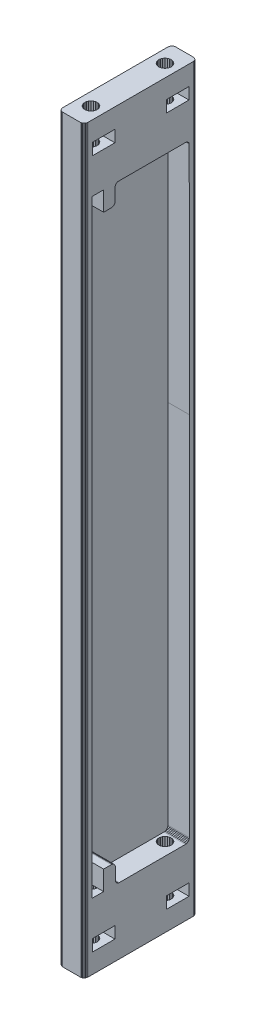
from build123d import *

# Parameters (mm, degrees)
BOSS_EXTRUDE1_DEPTH = 189.99999523
SKETCH2_W           = 5.800001324
SKETCH2_H           = 3.000000491
CUT_EXTRUDE1_DEPTH  = 146.045679533
CUT_EXTRUDE2_REACH  = 202.516
SKETCH4_W           = 5.800001324
SKETCH4_H           = 2.999998629
CUT_EXTRUDE3_DEPTH  = 146.045679533
SKETCH5_W           = 5.800001323
SKETCH5_H           = 2.999998629
CUT_EXTRUDE4_DEPTH  = 146.045679533
CUT_EXTRUDE5_REACH  = 202.516
CUT_EXTRUDE6_REACH  = 202.516
SKETCH8_W           = 5.800001323
SKETCH8_H           = 3.000000491
CUT_EXTRUDE7_DEPTH  = 146.045679533
CUT_EXTRUDE8_REACH  = 202.516
CUT_EXTRUDE9_DEPTH  = 5.49999997
CUT_EXTRUDE10_DEPTH = 9.000003338
CUT_EXTRUDE11_DEPTH = 9.000003338
CUT_EXTRUDE12_DEPTH = 8.99999754
CUT_EXTRUDE13_DEPTH = 8.99999754


with BuildPart() as part:
    # Sketch1 → Boss-Extrude1 (new body)
    with BuildSketch(Plane(origin=(0, 129.999995232, 0), x_dir=(1, 0, 0), z_dir=(0, 1, 0))):
        Polygon((-2.749999985, 35.133976489), (-2.508819103, 35.034071654), (-2.249999903, 35.000000149), (2.249999903, 35.000000149), (2.508819103, 35.034071654), (2.749999985, 35.133976489), (2.957106801, 35.292893648), (3.116025357, 35.500001162), (3.215926001, 35.741180182), (3.250000067, 35.99999845), (3.250000067, 63.000001013), (3.215926001, 63.258819282), (3.116025357, 63.500002027), (2.957106801, 63.707105815), (2.749999985, 63.8660267), (2.508819103, 63.965924084), (2.249999903, 64.00000304), (-2.249999903, 64.00000304), (-2.508819103, 63.965924084), (-2.749999985, 63.8660267), (-2.957106801, 63.707105815), (-3.116025357, 63.500002027), (-3.215926001, 63.258819282), (-3.250000067, 63.000001013), (-3.250000067, 35.99999845), (-3.215926001, 35.741180182), (-3.116025357, 35.500001162), (-2.957106801, 35.292893648), align=None)
    extrude(amount=-BOSS_EXTRUDE1_DEPTH)

    # Sketch2 → Cut-Extrude1 (cut, through all)
    with BuildSketch(Plane(origin=(3.250000067, 0, 0), x_dir=(0, 0, -1), z_dir=(1, 0, 0))):
        with Locations((39.999999106, -53.499999753)):
            Rectangle(SKETCH2_W, SKETCH2_H)
    extrude(amount=-CUT_EXTRUDE1_DEPTH, mode=Mode.SUBTRACT)

    # Sketch3 → Cut-Extrude2 (cut, up to next)
    with BuildSketch(Plane.XZ.offset(59.999999998), mode=Mode.PRIVATE) as cut_extrude2_sk1:
        Polygon((-1.545481267, -40.414113551), (-1.385640586, -40.799997747), (-1.131370896, -41.13136977), (-0.800000038, -41.385639459), (-0.414110487, -41.545484215), (0, -41.600000113), (0.414110487, -41.545484215), (0.800000038, -41.385639459), (1.131370896, -41.13136977), (1.385640586, -40.799997747), (1.545481267, -40.414113551), (1.600000076, -39.999999106), (1.545481267, -39.585888386), (1.385640586, -39.200000465), (1.131370896, -38.868628442), (0.800000038, -38.614362478), (0.414110487, -38.454517722), (0, -38.400001824), (-0.414110487, -38.454517722), (-0.800000038, -38.614362478), (-1.131370896, -38.868628442), (-1.385640586, -39.200000465), (-1.545481267, -39.585888386), (-1.600000076, -39.999999106), align=None)
    cut_extrude2_tool1 = extrude(cut_extrude2_sk1.sketch, amount=-CUT_EXTRUDE2_REACH, mode=Mode.PRIVATE) & part.part
    add(cut_extrude2_tool1.solids().sort_by_distance((0, -60, -40))[0], mode=Mode.SUBTRACT)

    # Sketch4 → Cut-Extrude3 (cut, through all)
    with BuildSketch(Plane(origin=(3.250000067, 0, 0), x_dir=(0, 0, -1), z_dir=(1, 0, 0))):
        with Locations((39.999999106, 123.500000686)):
            Rectangle(SKETCH4_W, SKETCH4_H)
    extrude(amount=-CUT_EXTRUDE3_DEPTH, mode=Mode.SUBTRACT)

    # Sketch5 → Cut-Extrude4 (cut, through all)
    with BuildSketch(Plane(origin=(3.250000067, 0, 0), x_dir=(0, 0, -1), z_dir=(1, 0, 0))):
        with Locations((59.000000357, 123.500000686)):
            Rectangle(SKETCH5_W, SKETCH5_H)
    extrude(amount=-CUT_EXTRUDE4_DEPTH, mode=Mode.SUBTRACT)

    # Sketch6 → Cut-Extrude5 (cut, up to next)
    with BuildSketch(Plane(origin=(0, 129.999995232, 0), x_dir=(-1, 0, 0), z_dir=(0, 1, 0)), mode=Mode.PRIVATE) as cut_extrude5_sk1:
        Polygon((1.545481267, -39.585888386), (1.385640586, -39.200000465), (1.131370896, -38.868628442), (0.800000038, -38.614362478), (0.414110487, -38.454517722), (0, -38.400001824), (-0.414110487, -38.454517722), (-0.800000038, -38.614362478), (-1.131370896, -38.868628442), (-1.385640586, -39.200000465), (-1.545481267, -39.585888386), (-1.600000076, -39.999999106), (-1.545481267, -40.414113551), (-1.385640586, -40.799997747), (-1.131370896, -41.13136977), (-0.800000038, -41.385639459), (-0.414110487, -41.545484215), (0, -41.600000113), (0.414110487, -41.545484215), (0.800000038, -41.385639459), (1.131370896, -41.13136977), (1.385640586, -40.799997747), (1.545481267, -40.414113551), (1.600000076, -39.999999106), align=None)
    cut_extrude5_tool1 = extrude(cut_extrude5_sk1.sketch, amount=-CUT_EXTRUDE5_REACH, mode=Mode.PRIVATE) & part.part
    add(cut_extrude5_tool1.solids().sort_by_distance((0, 129.999995, -40))[0], mode=Mode.SUBTRACT)

    # Sketch7 → Cut-Extrude6 (cut, up to next)
    with BuildSketch(Plane(origin=(0, 129.999995232, 0), x_dir=(-1, 0, 0), z_dir=(0, 1, 0)), mode=Mode.PRIVATE) as cut_extrude6_sk1:
        Polygon((-1.600000076, -59.000000358), (-1.545481267, -59.414111078), (-1.385640586, -59.799998999), (-1.131370896, -60.131371021), (-0.800000038, -60.385640711), (-0.414110487, -60.545481741), (0, -60.59999764), (0.414110487, -60.545481741), (0.800000038, -60.385640711), (1.131370896, -60.131371021), (1.385640586, -59.799998999), (1.545481267, -59.414111078), (1.600000076, -59.000000358), (1.545481267, -58.585889637), (1.385640586, -58.200001717), (1.131370896, -57.868629694), (0.800000038, -57.614360005), (0.414110487, -57.454518974), (0, -57.400003076), (-0.414110487, -57.454518974), (-0.800000038, -57.614360005), (-1.131370896, -57.868629694), (-1.385640586, -58.200001717), (-1.545481267, -58.585889637), align=None)
    cut_extrude6_tool1 = extrude(cut_extrude6_sk1.sketch, amount=-CUT_EXTRUDE6_REACH, mode=Mode.PRIVATE) & part.part
    add(cut_extrude6_tool1.solids().sort_by_distance((0, 129.999995, -59))[0], mode=Mode.SUBTRACT)

    # Sketch8 → Cut-Extrude7 (cut, through all)
    with BuildSketch(Plane(origin=(3.250000067, 0, 0), x_dir=(0, 0, -1), z_dir=(1, 0, 0))):
        with Locations((59.000000357, -53.499999753)):
            Rectangle(SKETCH8_W, SKETCH8_H)
    extrude(amount=-CUT_EXTRUDE7_DEPTH, mode=Mode.SUBTRACT)

    # Sketch9 → Cut-Extrude8 (cut, up to next)
    with BuildSketch(Plane.XZ.offset(59.999999998), mode=Mode.PRIVATE) as cut_extrude8_sk1:
        Polygon((-0.800000038, -57.614360005), (-1.131370896, -57.868629694), (-1.385640586, -58.200001717), (-1.545481267, -58.585889637), (-1.600000076, -59.000000358), (-1.545481267, -59.414111078), (-1.385640586, -59.799998999), (-1.131370896, -60.131371021), (-0.800000038, -60.385640711), (-0.414110487, -60.545481741), (0, -60.59999764), (0.414110487, -60.545481741), (0.800000038, -60.385640711), (1.131370896, -60.131371021), (1.385640586, -59.799998999), (1.545481267, -59.414111078), (1.600000076, -59.000000358), (1.545481267, -58.585889637), (1.385640586, -58.200001717), (1.131370896, -57.868629694), (0.800000038, -57.614360005), (0.414110487, -57.454518974), (0, -57.400003076), (-0.414110487, -57.454518974), align=None)
    cut_extrude8_tool1 = extrude(cut_extrude8_sk1.sketch, amount=-CUT_EXTRUDE8_REACH, mode=Mode.PRIVATE) & part.part
    add(cut_extrude8_tool1.solids().sort_by_distance((0, -60, -59))[0], mode=Mode.SUBTRACT)

    # Sketch10 → Cut-Extrude9 (cut)
    with BuildSketch(Plane(origin=(3.250000067, 0, 0), x_dir=(0, 0, -1), z_dir=(1, 0, 0))):
        with BuildLine():
            Line((61.999998987, -42.000003666), (61.999998987, 52.000000566))
            Line((61.999998987, 52.000000566), (61.965927482, 112.258821726))
            Line((61.965927482, 112.258821726), (61.866022646, 112.49999702))
            Line((61.866022646, 112.49999702), (61.707109213, 112.707108259))
            Line((61.707109213, 112.707108259), (61.500001699, 112.866029143))
            Line((61.500001699, 112.866029143), (61.258818954, 112.965926528))
            Line((61.258818954, 112.965926528), (61.000000685, 112.999998033))
            Line((61.000000685, 112.999998033), (43.999999762, 112.999998033))
            ThreePointArc((43.999999762, 112.999998033), (43.329460356, 112.84357352), (42.96592623, 112.258821726))
            Line((42.96592623, 112.258821726), (42.96592623, 108.74117434))
            Line((42.96592623, 108.74117434), (42.86602512, 108.499991596))
            Line((42.86602512, 108.499991596), (42.707107961, 108.292887807))
            Line((42.707107961, 108.292887807), (42.500000447, 108.133966923))
            Line((42.500000447, 108.133966923), (42.258821428, 108.034069538))
            Line((42.258821428, 108.034069538), (41.999999434, 107.999998033))
            Line((41.999999434, 107.999998033), (39.999999106, 107.999998033))
            Line((39.999999106, 107.999998033), (39.999999106, 112.999998033))
            Line((39.999999106, 112.999998033), (37.000000477, 112.999998033))
            Line((37.000000477, 112.999998033), (37.000000477, -43.000001967))
            Line((37.000000477, -43.000001967), (39.999999106, -43.000001967))
            Line((39.999999106, -43.000001967), (39.999999106, -38.00000301))
            Line((39.999999106, -38.00000301), (41.999999434, -38.00000301))
            Line((41.999999434, -38.00000301), (42.258821428, -38.03407824))
            Line((42.258821428, -38.03407824), (42.500000447, -38.133977488))
            Line((42.500000447, -38.133977488), (42.707107961, -38.292894647))
            Line((42.707107961, -38.292894647), (42.86602512, -38.500002161))
            Line((42.86602512, -38.500002161), (42.96592623, -38.741183043))
            Line((42.96592623, -38.741183043), (43.00000146, -39.000003174))
            Line((43.00000146, -39.000003174), (43.00000146, -42.000003666))
            Line((43.00000146, -42.000003666), (43.034072965, -42.258821934))
            Line((43.034072965, -42.258821934), (43.133977801, -42.500002816))
            Line((43.133977801, -42.500002816), (43.292891234, -42.70711033))
            Line((43.292891234, -42.70711033), (43.499998748, -42.866029352))
            Line((43.499998748, -42.866029352), (43.741181493, -42.965928599))
            Line((43.741181493, -42.965928599), (43.999999762, -43.000001967))
            Line((43.999999762, -43.000001967), (61.000000685, -43.000001967))
            Line((61.000000685, -43.000001967), (61.258818954, -42.965928599))
            Line((61.258818954, -42.965928599), (61.500001699, -42.866029352))
            Line((61.500001699, -42.866029352), (61.707109213, -42.70711033))
            Line((61.707109213, -42.70711033), (61.866022646, -42.500002816))
            Line((61.866022646, -42.500002816), (61.965927482, -42.258821934))
            Line((61.965927482, -42.258821934), (61.999998987, -42.000003666))
        make_face()
    extrude(amount=-CUT_EXTRUDE9_DEPTH, mode=Mode.SUBTRACT)

    # Sketch11 → Cut-Extrude10 (cut)
    with BuildSketch(Plane(origin=(0, 122.000001371, 0), x_dir=(-1, 0, 0), z_dir=(0, 1, 0))):
        Polygon((1.545481267, -40.414113551), (1.600000076, -39.999999106), (1.545481267, -39.585888386), (1.385640586, -39.200000465), (1.131370896, -38.868628442), (0.800000038, -38.614362478), (0.414110487, -38.454517722), (0, -38.400001824), (-0.414110487, -38.454517722), (-0.800000038, -38.614362478), (-1.131370896, -38.868628442), (-1.385640586, -39.200000465), (-1.545481267, -39.585888386), (-1.600000076, -39.999999106), (-1.545481267, -40.414113551), (-1.385640586, -40.799997747), (-1.131370896, -41.13136977), (-0.800000038, -41.385639459), (-0.414110487, -41.545484215), (0, -41.600000113), (0.414110487, -41.545484215), (0.800000038, -41.385639459), (1.131370896, -41.13136977), (1.385640586, -40.799997747), align=None)
    extrude(amount=-CUT_EXTRUDE10_DEPTH, mode=Mode.SUBTRACT)

    # Sketch12 → Cut-Extrude11 (cut)
    with BuildSketch(Plane(origin=(0, 122.000001371, 0), x_dir=(-1, 0, 0), z_dir=(0, 1, 0))):
        Polygon((1.545481267, -59.414111078), (1.600000076, -59.000000358), (1.545481267, -58.585889637), (1.385640586, -58.200001717), (1.131370896, -57.868629694), (0.800000038, -57.614360005), (0.414110487, -57.454518974), (0, -57.400003076), (-0.414110487, -57.454518974), (-0.800000038, -57.614360005), (-1.131370896, -57.868629694), (-1.385640586, -58.200001717), (-1.545481267, -58.585889637), (-1.600000076, -59.000000358), (-1.545481267, -59.414111078), (-1.385640586, -59.799998999), (-1.131370896, -60.131371021), (-0.800000038, -60.385640711), (-0.414110487, -60.545481741), (0, -60.59999764), (0.414110487, -60.545481741), (0.800000038, -60.385640711), (1.131370896, -60.131371021), (1.385640586, -59.799998999), align=None)
    extrude(amount=-CUT_EXTRUDE11_DEPTH, mode=Mode.SUBTRACT)

    # Sketch13 → Cut-Extrude12 (cut)
    with BuildSketch(Plane.XZ.offset(51.999999507)):
        Polygon((-0.414110487, -41.545484215), (0, -41.600000113), (0.414110487, -41.545484215), (0.800000038, -41.385639459), (1.131370896, -41.13136977), (1.385640586, -40.799997747), (1.545481267, -40.414113551), (1.600000076, -39.999999106), (1.545481267, -39.585888386), (1.385640586, -39.200000465), (1.131370896, -38.868628442), (0.800000038, -38.614362478), (0.414110487, -38.454517722), (0, -38.400001824), (-0.414110487, -38.454517722), (-0.800000038, -38.614362478), (-1.131370896, -38.868628442), (-1.385640586, -39.200000465), (-1.545481267, -39.585888386), (-1.600000076, -39.999999106), (-1.545481267, -40.414113551), (-1.385640586, -40.799997747), (-1.131370896, -41.13136977), (-0.800000038, -41.385639459), align=None)
    extrude(amount=-CUT_EXTRUDE12_DEPTH, mode=Mode.SUBTRACT)

    # Sketch14 → Cut-Extrude13 (cut)
    with BuildSketch(Plane.XZ.offset(51.999999507)):
        Polygon((-0.414110487, -60.545481741), (0, -60.59999764), (0.414110487, -60.545481741), (0.800000038, -60.385640711), (1.131370896, -60.131371021), (1.385640586, -59.799998999), (1.545481267, -59.414111078), (1.600000076, -59.000000358), (1.545481267, -58.585889637), (1.385640586, -58.200001717), (1.131370896, -57.868629694), (0.800000038, -57.614360005), (0.414110487, -57.454518974), (0, -57.400003076), (-0.414110487, -57.454518974), (-0.800000038, -57.614360005), (-1.131370896, -57.868629694), (-1.385640586, -58.200001717), (-1.545481267, -58.585889637), (-1.600000076, -59.000000358), (-1.545481267, -59.414111078), (-1.385640586, -59.799998999), (-1.131370896, -60.131371021), (-0.800000038, -60.385640711), align=None)
    extrude(amount=-CUT_EXTRUDE13_DEPTH, mode=Mode.SUBTRACT)


solid = part.part
